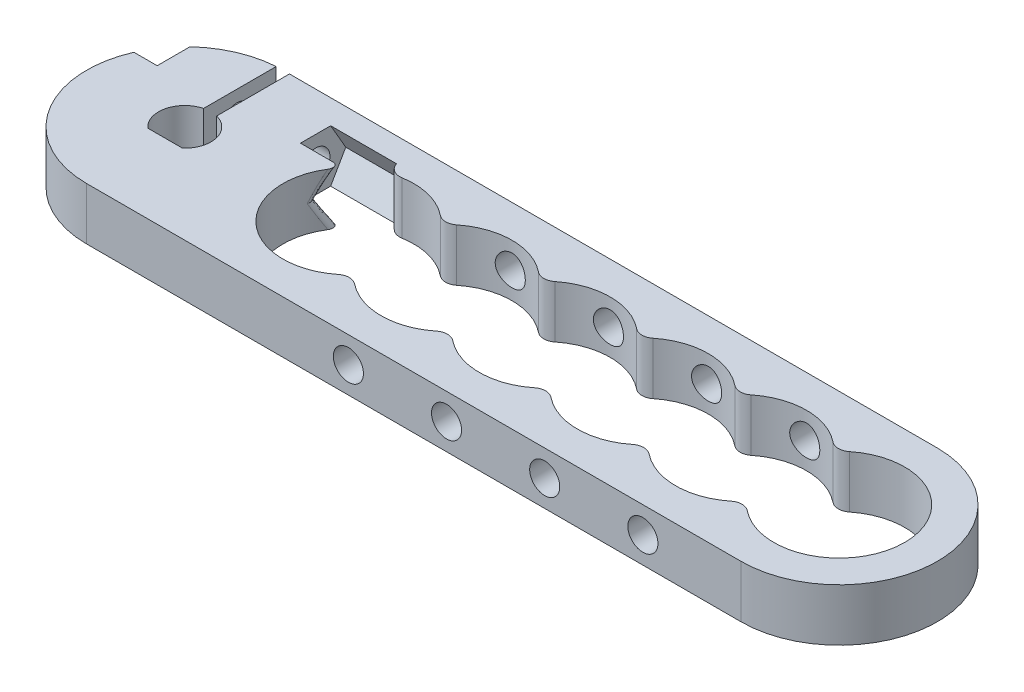
from build123d import *

# Parameters (mm, degrees)
EXTRUDE_1_DEPTH             = 4
SKETCH_3_W                  = 1
SKETCH_3_H                  = 9.111222706
CUT_EXTRUDE_1_DEPTH         = 59.124865591
HOLE_WIZARD_M21_D           = 2.2
HOLE_WIZARD_M21_DEPTH       = 15
HOLE_WIZARD_M21_CBORE_D     = 5
HOLE_WIZARD_M21_CBORE_DEPTH = 2.4
HOLE_WIZARD_M21_TIP         = 0.660946681
CUT_EXTRUDE_START           = -13
CUT_EXTRUDE_2_DEPTH         = 5
FILLET_1_R                  = 1
FILLET_2_R                  = 0.4
FILLET_3_R                  = 1
HOLE_WIZARD_M2_21_D         = 2.3
HOLE_WIZARD_M2_21_DEPTH     = 15
HOLE_WIZARD_M2_21_TIP       = 0.690989712


with BuildPart() as part:
    # Эскиз2 → Бобышка-Вытянуть1 (new body)
    with BuildSketch(Plane(origin=(0, 0, 0), x_dir=(1, 0, 0), z_dir=(0, 1, 0))):
        with BuildLine():
            Line((50, 7.5), (0, 7.5))
            ThreePointArc((0, 7.5), (-7.5, 0), (0, -7.5))
            Line((0, -7.5), (50, -7.5))
            ThreePointArc((50, -7.5), (57.5, 0), (50, 7.5))
        make_face()
        with BuildLine():
            Line((1.322875656, -1.5), (-1.322875656, -1.5))
            ThreePointArc((-1.322875656, -1.5), (0, 2), (1.322875656, -1.5))
        make_face(mode=Mode.SUBTRACT)
        with BuildLine():
            ThreePointArc((46.25, 3.307189139), (55, 0), (46.25, -3.307189139))
            ThreePointArc((46.25, -3.307189139), (42.5, -5), (38.75, -3.307189139))
            ThreePointArc((38.75, -3.307189139), (35, -5), (31.25, -3.307189139))
            ThreePointArc((31.25, -3.307189139), (27.5, -5), (23.75, -3.307189139))
            ThreePointArc((23.75, -3.307189139), (20, -5), (16.25, -3.307189139))
            ThreePointArc((16.25, -3.307189139), (7.5, 0), (16.25, 3.307189139))
            ThreePointArc((16.25, 3.307189139), (20, 5), (23.75, 3.307189139))
            ThreePointArc((23.75, 3.307189139), (27.5, 5), (31.25, 3.307189139))
            ThreePointArc((31.25, 3.307189139), (35, 5), (38.75, 3.307189139))
            ThreePointArc((38.75, 3.307189139), (42.5, 5), (46.25, 3.307189139))
        make_face(mode=Mode.SUBTRACT)
    extrude(amount=EXTRUDE_1_DEPTH)

    # Эскиз3 → Вырез-Вытянуть1 (cut, through all)
    with BuildSketch(Plane(origin=(0, 4, 0), x_dir=(1, 0, 0), z_dir=(0, 1, 0))):
        with Locations((0, 4.555611353)):
            Rectangle(SKETCH_3_W, SKETCH_3_H)
    extrude(amount=-CUT_EXTRUDE_1_DEPTH, mode=Mode.SUBTRACT)

    # Цековка для винта с внутренним шестигранником M21
    with Locations(Plane.ZY.offset(7.5)):
        with Locations((-4.491631287, 2)):
            CounterBoreHole(HOLE_WIZARD_M21_D / 2, HOLE_WIZARD_M21_CBORE_D / 2, HOLE_WIZARD_M21_CBORE_DEPTH, depth=HOLE_WIZARD_M21_DEPTH)
            with Locations((0, 0, -(HOLE_WIZARD_M21_DEPTH + HOLE_WIZARD_M21_TIP / 2))):  # 118° drill point
                Cone(0, HOLE_WIZARD_M21_D / 2, HOLE_WIZARD_M21_TIP, mode=Mode.SUBTRACT)

    # Эскиз9 → Вырез-Вытянуть2 (cut)
    with BuildSketch(Plane.ZY.offset(7.5).offset(CUT_EXTRUDE_START)):
        Polygon((-6.801032364, 2), (-5.646331826, 0), (-3.336930749, 0), (-2.18223021, 2), (-3.336930749, 4), (-5.646331826, 4), align=None)
    extrude(amount=-CUT_EXTRUDE_2_DEPTH, mode=Mode.SUBTRACT)

    # Скругление1
    fillet_1_edges = [part.edges().sort_by_distance(p)[0] for p in [
        (10.5, 2, -4.582575695),
    ]]
    fillet(fillet_1_edges, radius=FILLET_1_R)

    # Скругление2
    fillet_2_edges = [part.edges().sort_by_distance(p)[0] for p in [
        (8.336376303, 3.015338157, -2.768435969),
        (8.336376303, 0.984661843, -2.768435969),
    ]]
    fillet(fillet_2_edges, radius=FILLET_2_R)

    # Скругление3
    fillet_3_edges = [part.edges().sort_by_distance(p)[0] for p in [
        (23.75, 2, 3.307189139),
        (31.25, 2, 3.307189139),
        (38.75, 2, 3.307189139),
        (46.25, 2, 3.307189139),
        (46.25, 2, -3.307189139),
        (38.75, 2, -3.307189139),
        (31.25, 2, -3.307189139),
        (23.75, 2, -3.307189139),
        (16.25, 2, -3.307189139),
        (16.25, 2, 3.307189139),
    ]]
    fillet(fillet_3_edges, radius=FILLET_3_R)

    # Сверло под метчик  спиральное M2.21
    with Locations(Plane(origin=(0, 0, -7.5), x_dir=(-1, 0, 0), z_dir=(0, 0, -1))):
        with Locations((-20, 2), (-42.5, 2), (-35, 2), (-27.5, 2)):
            Hole(HOLE_WIZARD_M2_21_D / 2, depth=HOLE_WIZARD_M2_21_DEPTH)
            with Locations((0, 0, -(HOLE_WIZARD_M2_21_DEPTH + HOLE_WIZARD_M2_21_TIP / 2))):  # 118° drill point
                Cone(0, HOLE_WIZARD_M2_21_D / 2, HOLE_WIZARD_M2_21_TIP, mode=Mode.SUBTRACT)


solid = part.part
